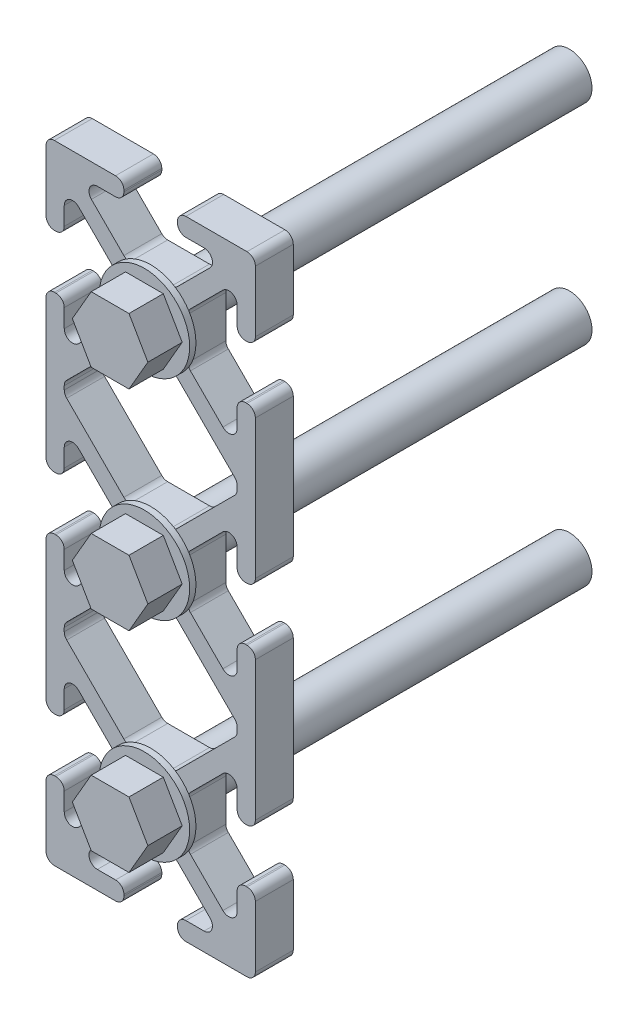
from build123d import *

# Parameters (mm, degrees)
SKETCH1_R            = 2.6035
MAIN_EXTRUSION_DEPTH = 2.2987
SKETCH3_R            = 5.4864
BOSS_EXTRUDE1_DEPTH  = 0.762
BOSS_EXTRUDE2_DEPTH  = 4.1656
SKETCH5_R            = 2.7432
BOSS_EXTRUDE3_DEPTH  = 50.8


with BuildPart() as part:
    # Sketch1 → Main Extrusion (new, symmetric)
    with BuildSketch(Plane.XY):
        with BuildLine():
            Line((-12.7, 37.084), (-12.7, 29.6672))
            ThreePointArc((-12.7, 29.6672), (-12.40242049, 28.94877951), (-11.684, 28.6512))
            Line((-11.684, 28.6512), (-11.5062, 28.6512))
            ThreePointArc((-11.5062, 28.6512), (-10.78777951, 28.94877951), (-10.4902, 29.6672))
            Line((-10.4902, 29.6672), (-10.4902, 31.874794456))
            ThreePointArc((-10.4902, 31.874794456), (-9.863006367, 32.813456061), (-8.75577951, 32.593214945))
            Line((-8.75577951, 32.593214945), (-4.81877951, 28.656214945))
            ThreePointArc((-4.81877951, 28.656214945), (-4.598538395, 28.326600823), (-4.5212, 27.937794456))
            Line((-4.5212, 27.937794456), (-4.5212, 22.862205544))
            ThreePointArc((-4.5212, 22.862205544), (-4.598538395, 22.473399177), (-4.81877951, 22.143785055))
            Line((-4.81877951, 22.143785055), (-8.75577951, 18.206785055))
            ThreePointArc((-8.75577951, 18.206785055), (-9.863006367, 17.986543939), (-10.4902, 18.925205544))
            Line((-10.4902, 18.925205544), (-10.4902, 21.1328))
            ThreePointArc((-10.4902, 21.1328), (-10.78777951, 21.85122049), (-11.5062, 22.1488))
            Line((-11.5062, 22.1488), (-11.684, 22.1488))
            ThreePointArc((-11.684, 22.1488), (-12.40242049, 21.85122049), (-12.7, 21.1328))
            Line((-12.7, 21.1328), (-12.7, 4.2672))
            ThreePointArc((-12.7, 4.2672), (-12.40242049, 3.54877951), (-11.684, 3.2512))
            Line((-11.684, 3.2512), (-11.5062, 3.2512))
            ThreePointArc((-11.5062, 3.2512), (-10.78777951, 3.54877951), (-10.4902, 4.2672))
            Line((-10.4902, 4.2672), (-10.4902, 6.474794456))
            ThreePointArc((-10.4902, 6.474794456), (-9.863006367, 7.413456061), (-8.75577951, 7.193214945))
            Line((-8.75577951, 7.193214945), (-4.81877951, 3.256214945))
            ThreePointArc((-4.81877951, 3.256214945), (-4.598538395, 2.926600823), (-4.5212, 2.537794456))
            Line((-4.5212, 2.537794456), (-4.5212, -2.537794456))
            ThreePointArc((-4.5212, -2.537794456), (-4.598538395, -2.926600823), (-4.81877951, -3.256214945))
            Line((-4.81877951, -3.256214945), (-8.75577951, -7.193214945))
            ThreePointArc((-8.75577951, -7.193214945), (-9.863006367, -7.413456061), (-10.4902, -6.474794456))
            Line((-10.4902, -6.474794456), (-10.4902, -4.2672))
            ThreePointArc((-10.4902, -4.2672), (-10.78777951, -3.54877951), (-11.5062, -3.2512))
            Line((-11.5062, -3.2512), (-11.684, -3.2512))
            ThreePointArc((-11.684, -3.2512), (-12.40242049, -3.54877951), (-12.7, -4.2672))
            Line((-12.7, -4.2672), (-12.7, -21.1328))
            ThreePointArc((-12.7, -21.1328), (-12.40242049, -21.85122049), (-11.684, -22.1488))
            Line((-11.684, -22.1488), (-11.5062, -22.1488))
            ThreePointArc((-11.5062, -22.1488), (-10.78777951, -21.85122049), (-10.4902, -21.1328))
            Line((-10.4902, -21.1328), (-10.4902, -18.925205544))
            ThreePointArc((-10.4902, -18.925205544), (-9.863006367, -17.986543939), (-8.75577951, -18.206785055))
            Line((-8.75577951, -18.206785055), (-4.81877951, -22.143785055))
            ThreePointArc((-4.81877951, -22.143785055), (-4.598538395, -22.473399177), (-4.5212, -22.862205544))
            Line((-4.5212, -22.862205544), (-4.5212, -27.937794456))
            ThreePointArc((-4.5212, -27.937794456), (-4.598538395, -28.326600823), (-4.81877951, -28.656214945))
            Line((-4.81877951, -28.656214945), (-8.75577951, -32.593214945))
            ThreePointArc((-8.75577951, -32.593214945), (-9.863006367, -32.813456061), (-10.4902, -31.874794456))
            Line((-10.4902, -31.874794456), (-10.4902, -29.6672))
            ThreePointArc((-10.4902, -29.6672), (-10.78777951, -28.94877951), (-11.5062, -28.6512))
            Line((-11.5062, -28.6512), (-11.684, -28.6512))
            ThreePointArc((-11.684, -28.6512), (-12.40242049, -28.94877951), (-12.7, -29.6672))
            Line((-12.7, -29.6672), (-12.7, -37.084))
            ThreePointArc((-12.7, -37.084), (-12.40242049, -37.80242049), (-11.684, -38.1))
            Line((-11.684, -38.1), (-4.2672, -38.1))
            ThreePointArc((-4.2672, -38.1), (-3.54877951, -37.80242049), (-3.2512, -37.084))
            Line((-3.2512, -37.084), (-3.2512, -36.9062))
            ThreePointArc((-3.2512, -36.9062), (-3.54877951, -36.18777951), (-4.2672, -35.8902))
            Line((-4.2672, -35.8902), (-6.474794456, -35.8902))
            ThreePointArc((-6.474794456, -35.8902), (-7.413456061, -35.263006367), (-7.193214945, -34.15577951))
            Line((-7.193214945, -34.15577951), (-3.256214945, -30.21877951))
            ThreePointArc((-3.256214945, -30.21877951), (-2.926600823, -29.998538395), (-2.537794456, -29.9212))
            Line((-2.537794456, -29.9212), (2.537794456, -29.9212))
            ThreePointArc((2.537794456, -29.9212), (2.926600823, -29.998538395), (3.256214945, -30.21877951))
            Line((3.256214945, -30.21877951), (7.193214945, -34.15577951))
            ThreePointArc((7.193214945, -34.15577951), (7.413456061, -35.263006367), (6.474794456, -35.8902))
            Line((6.474794456, -35.8902), (4.2672, -35.8902))
            ThreePointArc((4.2672, -35.8902), (3.54877951, -36.18777951), (3.2512, -36.9062))
            Line((3.2512, -36.9062), (3.2512, -37.084))
            ThreePointArc((3.2512, -37.084), (3.54877951, -37.80242049), (4.2672, -38.1))
            Line((4.2672, -38.1), (11.684, -38.1))
            ThreePointArc((11.684, -38.1), (12.40242049, -37.80242049), (12.7, -37.084))
            Line((12.7, -37.084), (12.7, -29.6672))
            ThreePointArc((12.7, -29.6672), (12.40242049, -28.94877951), (11.684, -28.6512))
            Line((11.684, -28.6512), (11.5062, -28.6512))
            ThreePointArc((11.5062, -28.6512), (10.78777951, -28.94877951), (10.4902, -29.6672))
            Line((10.4902, -29.6672), (10.4902, -31.874794456))
            ThreePointArc((10.4902, -31.874794456), (9.863006367, -32.813456061), (8.75577951, -32.593214945))
            Line((8.75577951, -32.593214945), (4.81877951, -28.656214945))
            ThreePointArc((4.81877951, -28.656214945), (4.598538395, -28.326600823), (4.5212, -27.937794456))
            Line((4.5212, -27.937794456), (4.5212, -22.862205544))
            ThreePointArc((4.5212, -22.862205544), (4.598538395, -22.473399177), (4.81877951, -22.143785055))
            Line((4.81877951, -22.143785055), (8.75577951, -18.206785055))
            ThreePointArc((8.75577951, -18.206785055), (9.863006367, -17.986543939), (10.4902, -18.925205544))
            Line((10.4902, -18.925205544), (10.4902, -21.1328))
            ThreePointArc((10.4902, -21.1328), (10.78777951, -21.85122049), (11.5062, -22.1488))
            Line((11.5062, -22.1488), (11.684, -22.1488))
            ThreePointArc((11.684, -22.1488), (12.40242049, -21.85122049), (12.7, -21.1328))
            Line((12.7, -21.1328), (12.7, -4.2672))
            ThreePointArc((12.7, -4.2672), (12.40242049, -3.54877951), (11.684, -3.2512))
            Line((11.684, -3.2512), (11.5062, -3.2512))
            ThreePointArc((11.5062, -3.2512), (10.78777951, -3.54877951), (10.4902, -4.2672))
            Line((10.4902, -4.2672), (10.4902, -6.474794456))
            ThreePointArc((10.4902, -6.474794456), (9.863006367, -7.413456061), (8.75577951, -7.193214945))
            Line((8.75577951, -7.193214945), (4.81877951, -3.256214945))
            ThreePointArc((4.81877951, -3.256214945), (4.598538395, -2.926600823), (4.5212, -2.537794456))
            Line((4.5212, -2.537794456), (4.5212, 2.537794456))
            ThreePointArc((4.5212, 2.537794456), (4.598538395, 2.926600823), (4.81877951, 3.256214945))
            Line((4.81877951, 3.256214945), (8.75577951, 7.193214945))
            ThreePointArc((8.75577951, 7.193214945), (9.863006367, 7.413456061), (10.4902, 6.474794456))
            Line((10.4902, 6.474794456), (10.4902, 4.2672))
            ThreePointArc((10.4902, 4.2672), (10.78777951, 3.54877951), (11.5062, 3.2512))
            Line((11.5062, 3.2512), (11.684, 3.2512))
            ThreePointArc((11.684, 3.2512), (12.40242049, 3.54877951), (12.7, 4.2672))
            Line((12.7, 4.2672), (12.7, 21.1328))
            ThreePointArc((12.7, 21.1328), (12.40242049, 21.85122049), (11.684, 22.1488))
            Line((11.684, 22.1488), (11.5062, 22.1488))
            ThreePointArc((11.5062, 22.1488), (10.78777951, 21.85122049), (10.4902, 21.1328))
            Line((10.4902, 21.1328), (10.4902, 18.925205544))
            ThreePointArc((10.4902, 18.925205544), (9.863006367, 17.986543939), (8.75577951, 18.206785055))
            Line((8.75577951, 18.206785055), (4.81877951, 22.143785055))
            ThreePointArc((4.81877951, 22.143785055), (4.598538395, 22.473399177), (4.5212, 22.862205544))
            Line((4.5212, 22.862205544), (4.5212, 27.937794456))
            ThreePointArc((4.5212, 27.937794456), (4.598538395, 28.326600823), (4.81877951, 28.656214945))
            Line((4.81877951, 28.656214945), (8.75577951, 32.593214945))
            ThreePointArc((8.75577951, 32.593214945), (9.863006367, 32.813456061), (10.4902, 31.874794456))
            Line((10.4902, 31.874794456), (10.4902, 29.6672))
            ThreePointArc((10.4902, 29.6672), (10.78777951, 28.94877951), (11.5062, 28.6512))
            Line((11.5062, 28.6512), (11.684, 28.6512))
            ThreePointArc((11.684, 28.6512), (12.40242049, 28.94877951), (12.7, 29.6672))
            Line((12.7, 29.6672), (12.7, 37.084))
            ThreePointArc((12.7, 37.084), (12.40242049, 37.80242049), (11.684, 38.1))
            Line((11.684, 38.1), (4.2672, 38.1))
            ThreePointArc((4.2672, 38.1), (3.54877951, 37.80242049), (3.2512, 37.084))
            Line((3.2512, 37.084), (3.2512, 36.9062))
            ThreePointArc((3.2512, 36.9062), (3.54877951, 36.18777951), (4.2672, 35.8902))
            Line((4.2672, 35.8902), (6.474794456, 35.8902))
            ThreePointArc((6.474794456, 35.8902), (7.413456061, 35.263006367), (7.193214945, 34.15577951))
            Line((7.193214945, 34.15577951), (3.256214945, 30.21877951))
            ThreePointArc((3.256214945, 30.21877951), (2.926600823, 29.998538395), (2.537794456, 29.9212))
            Line((2.537794456, 29.9212), (-2.537794456, 29.9212))
            ThreePointArc((-2.537794456, 29.9212), (-2.926600823, 29.998538395), (-3.256214945, 30.21877951))
            Line((-3.256214945, 30.21877951), (-7.193214945, 34.15577951))
            ThreePointArc((-7.193214945, 34.15577951), (-7.413456061, 35.263006367), (-6.474794456, 35.8902))
            Line((-6.474794456, 35.8902), (-4.2672, 35.8902))
            ThreePointArc((-4.2672, 35.8902), (-3.54877951, 36.18777951), (-3.2512, 36.9062))
            Line((-3.2512, 36.9062), (-3.2512, 37.084))
            ThreePointArc((-3.2512, 37.084), (-3.54877951, 37.80242049), (-4.2672, 38.1))
            Line((-4.2672, 38.1), (-11.684, 38.1))
            ThreePointArc((-11.684, 38.1), (-12.40242049, 37.80242049), (-12.7, 37.084))
        make_face()
        with Locations((0, 25.4)):
            Circle(SKETCH1_R, mode=Mode.SUBTRACT)
        Circle(SKETCH1_R, mode=Mode.SUBTRACT)
        with Locations((0, -25.4)):
            Circle(SKETCH1_R, mode=Mode.SUBTRACT)
        with BuildLine():
            Line((-10.4902, 12.473605544), (-10.4902, 12.926394456))
            ThreePointArc((-10.4902, 12.926394456), (-10.412861605, 13.315200823), (-10.19262049, 13.644814945))
            Line((-10.19262049, 13.644814945), (-3.256214945, 20.58122049))
            ThreePointArc((-3.256214945, 20.58122049), (-2.926600823, 20.801461605), (-2.537794456, 20.8788))
            Line((-2.537794456, 20.8788), (2.537794456, 20.8788))
            ThreePointArc((2.537794456, 20.8788), (2.926600823, 20.801461605), (3.256214945, 20.58122049))
            Line((3.256214945, 20.58122049), (10.19262049, 13.644814945))
            ThreePointArc((10.19262049, 13.644814945), (10.412861605, 13.315200823), (10.4902, 12.926394456))
            Line((10.4902, 12.926394456), (10.4902, 12.473605544))
            ThreePointArc((10.4902, 12.473605544), (10.412861605, 12.084799177), (10.19262049, 11.755185055))
            Line((10.19262049, 11.755185055), (3.256214945, 4.81877951))
            ThreePointArc((3.256214945, 4.81877951), (2.926600823, 4.598538395), (2.537794456, 4.5212))
            Line((2.537794456, 4.5212), (-2.537794456, 4.5212))
            ThreePointArc((-2.537794456, 4.5212), (-2.926600823, 4.598538395), (-3.256214945, 4.81877951))
            Line((-3.256214945, 4.81877951), (-10.19262049, 11.755185055))
            ThreePointArc((-10.19262049, 11.755185055), (-10.412861605, 12.084799177), (-10.4902, 12.473605544))
        make_face(mode=Mode.SUBTRACT)
        with BuildLine():
            Line((-2.537794456, -4.5212), (2.537794456, -4.5212))
            ThreePointArc((2.537794456, -4.5212), (2.926600823, -4.598538395), (3.256214945, -4.81877951))
            Line((3.256214945, -4.81877951), (10.19262049, -11.755185055))
            ThreePointArc((10.19262049, -11.755185055), (10.412861605, -12.084799177), (10.4902, -12.473605544))
            Line((10.4902, -12.473605544), (10.4902, -12.926394456))
            ThreePointArc((10.4902, -12.926394456), (10.412861605, -13.315200823), (10.19262049, -13.644814945))
            Line((10.19262049, -13.644814945), (3.256214945, -20.58122049))
            ThreePointArc((3.256214945, -20.58122049), (2.926600823, -20.801461605), (2.537794456, -20.8788))
            Line((2.537794456, -20.8788), (-2.537794456, -20.8788))
            ThreePointArc((-2.537794456, -20.8788), (-2.926600823, -20.801461605), (-3.256214945, -20.58122049))
            Line((-3.256214945, -20.58122049), (-10.19262049, -13.644814945))
            ThreePointArc((-10.19262049, -13.644814945), (-10.412861605, -13.315200823), (-10.4902, -12.926394456))
            Line((-10.4902, -12.926394456), (-10.4902, -12.473605544))
            ThreePointArc((-10.4902, -12.473605544), (-10.412861605, -12.084799177), (-10.19262049, -11.755185055))
            Line((-10.19262049, -11.755185055), (-3.256214945, -4.81877951))
            ThreePointArc((-3.256214945, -4.81877951), (-2.926600823, -4.598538395), (-2.537794456, -4.5212))
        make_face(mode=Mode.SUBTRACT)
    extrude(amount=MAIN_EXTRUSION_DEPTH, both=True)

    # Sketch3 → Boss-Extrude1 (add)
    with BuildSketch(Plane.XY.offset(2.2987)):
        with Locations(Location((0, 25.4, 0), (0, 0, 212.721993141))):
            Circle(SKETCH3_R)
        with Locations(Location((0, 0, 0), (0, 0, 147.278006859))):
            Circle(SKETCH3_R)
        with Locations(Location((0, -25.4, 0), (0, 0, 147.278006859))):
            Circle(SKETCH3_R)
    extrude(amount=BOSS_EXTRUDE1_DEPTH)

    # Sketch4 → Boss-Extrude2 (add)
    with BuildSketch(Plane.XY.offset(3.0607)):
        Polygon((4.582717762, 0), (2.291358881, 3.96875), (-2.291358881, 3.96875), (-4.582717762, 0), (-2.291358881, -3.96875), (2.291358881, -3.96875), align=None)
        Polygon((4.582717762, 25.4), (2.291358881, 29.36875), (-2.291358881, 29.36875), (-4.582717762, 25.4), (-2.291358881, 21.43125), (2.291358881, 21.43125), align=None)
        Polygon((4.582717762, -25.4), (2.291358881, -21.43125), (-2.291358881, -21.43125), (-4.582717762, -25.4), (-2.291358881, -29.36875), (2.291358881, -29.36875), align=None)
    extrude(amount=BOSS_EXTRUDE2_DEPTH)

    # Sketch5 → Boss-Extrude3 (add)
    with BuildSketch(Plane(origin=(0, 0, 2.2987), x_dir=(-1, 0, 0), z_dir=(0, 0, -1))):
        Circle(SKETCH5_R)
        with Locations((0, 25.4)):
            Circle(SKETCH5_R)
        with Locations((0, -25.4)):
            Circle(SKETCH5_R)
    extrude(amount=BOSS_EXTRUDE3_DEPTH)


solid = part.part
